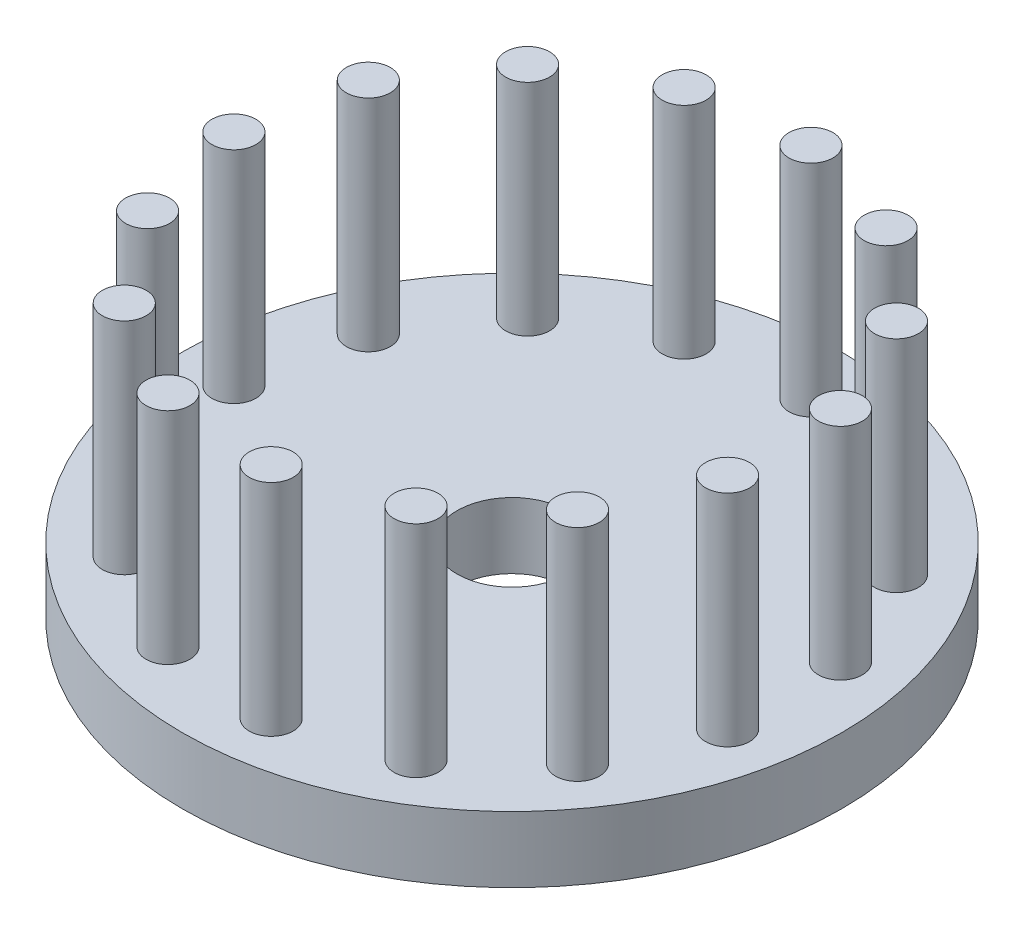
from build123d import *

# Parameters (mm, degrees)
SKETCH_1_R               = 15
SKETCH_1_R_2             = 2.5
EXTRUDE_1_DEPTH          = 3
SKETCH_2_R               = 1
EXTRUDE_2_DEPTH          = 10
PATTERN_CIRCULAR_1_COUNT = 15


with BuildPart() as part:
    # 草圖1 → 填料-伸長1 (new body)
    with BuildSketch(Plane(origin=(0, 0, 0), x_dir=(1, 0, 0), z_dir=(0, 1, 0))):
        with Locations(Location((0, 0, 0), (0, 0, 270))):
            Circle(SKETCH_1_R)
        with Locations(Location((0, 0, 0), (0, 0, 270))):
            Circle(SKETCH_1_R_2, mode=Mode.SUBTRACT)
    extrude(amount=EXTRUDE_1_DEPTH)

    # 草圖2 → 填料-伸長2 (add)
    with BuildSketch(Plane(origin=(0, 3, 0), x_dir=(1, 0, 0), z_dir=(0, 1, 0))):
        with Locations(Location((6.116820543, 10.901124091, 0), (0, 0, 270))):
            Circle(SKETCH_2_R)
    extrude_2 = extrude(amount=EXTRUDE_2_DEPTH)

    # 環狀複製排列1: 填料-伸長2 ×15 about axis
    pattern_circular_1_axis = Axis((0, 0, 0), (0, 1, 0))
    for i in range(1, PATTERN_CIRCULAR_1_COUNT):
        add(extrude_2.rotate(pattern_circular_1_axis, i * 360 / PATTERN_CIRCULAR_1_COUNT))


solid = part.part
